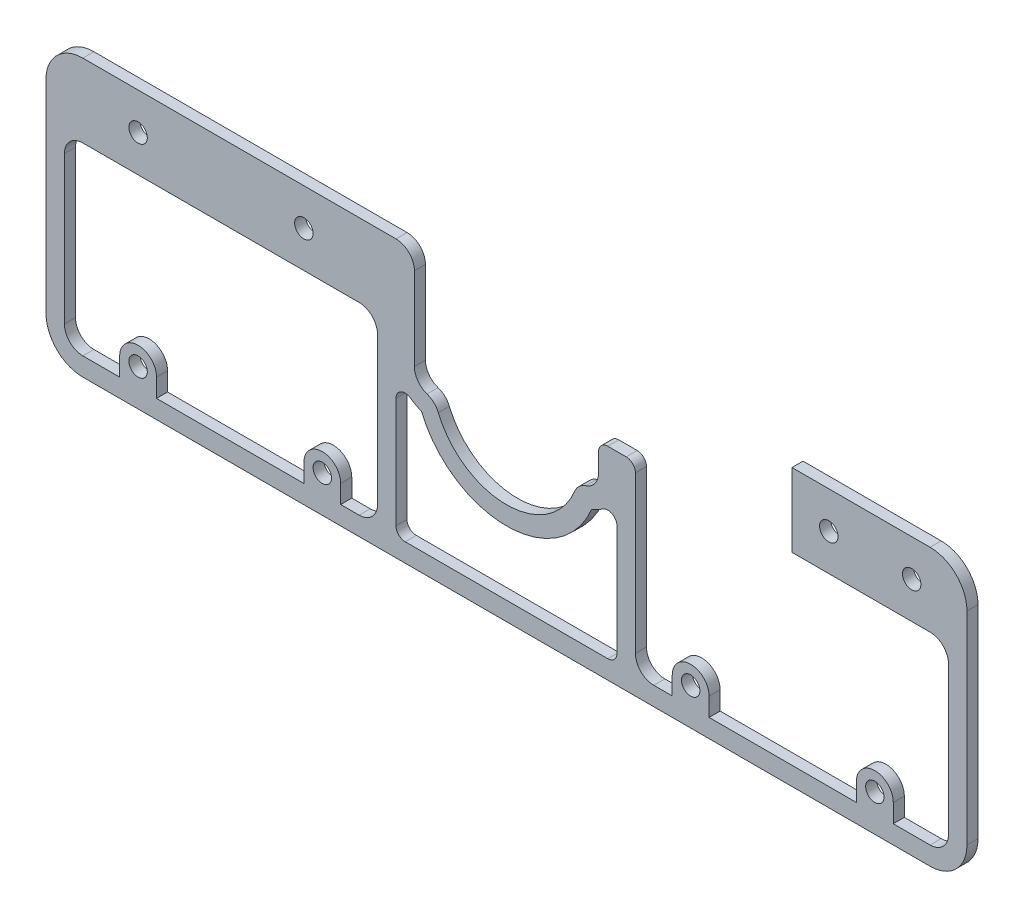
from build123d import *

# Parameters (mm, degrees)
BOSS_EXTRUDE1_DEPTH = 6
SKETCH3_R           = 5
CUT_EXTRUDE1_DEPTH  = 262.076617107
SKETCH4_R           = 5
CUT_EXTRUDE2_DEPTH  = 262.076617107
FILLET4_R           = 5
CUT_EXTRUDE5_DEPTH  = 262.076617107
FILLET5_R           = 5
FILLET6_R           = 5
CUT_EXTRUDE6_DEPTH  = 262.076617107
FILLET7_R           = 5


with BuildPart() as part:
    # Sketch1 → Boss-Extrude1 (new body)
    with BuildSketch(Plane.XY):
        with BuildLine():
            Line((-250, -55), (-250, 3.178280867))
            Line((-250, 3.178280867), (-250, 55))
            ThreePointArc((-250, 55), (-244.142135624, 69.142135624), (-230, 75))
            Line((-230, 75), (-220, 75))
            Line((-220, 75), (-164.330865428, 75))
            Line((-164.330865428, 75), (-60, 75))
            ThreePointArc((-60, 75), (-52.928932188, 72.071067812), (-50, 65))
            Line((-50, 65), (-50, 20))
            ThreePointArc((-50, 20), (-48.100925873, 14.1369803), (-43.125, 10.500822404))
            ThreePointArc((-43.125, 10.500822404), (-39.437786703, 8.32242004), (-37, 4.801315846))
            ThreePointArc((-37, 4.801315846), (-22.271648276, -13.226099426), (0, -20))
            Line((0, -20), (0, -40))
            Line((0, -40), (0, -65))
            Line((0, -65), (0, -75))
            Line((0, -75), (-230, -75))
            ThreePointArc((-230, -75), (-244.142135624, -69.142135624), (-250, -55))
        make_face()
    boss_extrude1 = extrude(amount=BOSS_EXTRUDE1_DEPTH)

    # Mirror1: Boss-Extrude1 across plane
    add(boss_extrude1.mirror(Plane(origin=(0, -20, 6), x_dir=(0, 0, 1), z_dir=(-1, 0, 0))))

    # Sketch3 → Cut-Extrude1 (cut, through all)
    with BuildSketch(Plane.XY.offset(6)):
        with BuildLine():
            Line((155, 35), (155, 75))
            Line((155, 75), (60, 75))
            ThreePointArc((60, 75), (52.928932188, 72.071067812), (50, 65))
            Line((50, 65), (50, 35))
            Line((50, 35), (155, 35))
        make_face()
        with Locations((175, 55)):
            Circle(SKETCH3_R)
        with Locations((220, 55)):
            Circle(SKETCH3_R)
        with Locations((-110, 55)):
            Circle(SKETCH3_R)
        with Locations((-200, 55)):
            Circle(SKETCH3_R)
    extrude(amount=-CUT_EXTRUDE1_DEPTH, mode=Mode.SUBTRACT)

    # Sketch4 → Cut-Extrude2 (cut, through all)
    with BuildSketch(Plane.XY.offset(6)):
        with Locations((-200, -55)):
            Circle(SKETCH4_R)
        with Locations((-100, -55)):
            Circle(SKETCH4_R)
        with BuildLine():
            Line((-70, 25.100979079), (-70, -54.899020921))
            ThreePointArc((-70, -54.899020921), (-72.928932188, -61.970088733), (-80, -64.899020921))
            Line((-80, -64.899020921), (-90, -64.899020921))
            Line((-90, -64.899020921), (-90, -55))
            ThreePointArc((-90, -55), (-100, -45), (-110, -55))
            Line((-110, -55), (-110, -65))
            Line((-110, -65), (-190, -65))
            Line((-190, -65), (-190, -55))
            ThreePointArc((-190, -55), (-200, -45), (-210, -55))
            Line((-210, -55), (-210, -65))
            Line((-210, -65), (-230, -65))
            ThreePointArc((-230, -65), (-237.071067812, -62.071067812), (-240, -55))
            Line((-240, -55), (-240, 25.100979079))
            ThreePointArc((-240, 25.100979079), (-237.071067812, 32.17204689), (-230, 35.100979079))
            Line((-230, 35.100979079), (-140, 35.100979079))
            Line((-140, 35.100979079), (-110, 35.100979079))
            Line((-110, 35.100979079), (-80, 35.100979079))
            ThreePointArc((-80, 35.100979079), (-72.928932188, 32.17204689), (-70, 25.100979079))
        make_face()
    cut_extrude2 = extrude(amount=-CUT_EXTRUDE2_DEPTH, mode=Mode.SUBTRACT)

    # Mirror2: Cut-Extrude2 across plane
    add(cut_extrude2.mirror(Plane(origin=(0, 0, 0), x_dir=(0, 0, 1), z_dir=(1, 0, 0))), mode=Mode.SUBTRACT)

    # Fillet4
    fillet4_edges = [part.edges().sort_by_distance(p)[0] for p in [
        (50, 35, 3),
    ]]
    fillet(fillet4_edges, radius=FILLET4_R)

    # Sketch8 → Cut-Extrude5 (cut, through all)
    with BuildSketch(Plane.XY.offset(6)):
        with BuildLine():
            Line((-60, 0), (-60, -64.899020921))
            Line((-60, -64.899020921), (60, -64.899020921))
            Line((60, -64.899020921), (60, 0))
            ThreePointArc((60, 0), (57.236067977, 4.472135955), (52, 4))
            ThreePointArc((52, 4), (49.247332505, 2.266223145), (46.25, 1.001644808))
            ThreePointArc((46.25, 1.001644808), (0, -30), (-46.25, 1.001644808))
            ThreePointArc((-46.25, 1.001644808), (-49.247332505, 2.266223145), (-52, 4))
            ThreePointArc((-52, 4), (-57.236067977, 4.472135955), (-60, 0))
        make_face()
    extrude(amount=-CUT_EXTRUDE5_DEPTH, mode=Mode.SUBTRACT)

    # Fillet5
    fillet5_edges = [part.edges().sort_by_distance(p)[0] for p in [
        (-60, -64.899020921, 3),
    ]]
    fillet(fillet5_edges, radius=FILLET5_R)

    # Fillet6
    fillet6_edges = [part.edges().sort_by_distance(p)[0] for p in [
        (60, -64.899020921, 3),
    ]]
    fillet(fillet6_edges, radius=FILLET6_R)

    # Sketch9 → Cut-Extrude6 (cut, through all)
    with BuildSketch(Plane.XY.offset(6)):
        with BuildLine():
            Line((78.582472294, 35), (70, 35))
            Line((70, 35), (70, 25.100979079))
            ThreePointArc((70, 25.100979079), (72.444363791, 31.651731819), (78.582472294, 35))
        make_face()
    extrude(amount=-CUT_EXTRUDE6_DEPTH, mode=Mode.SUBTRACT)

    # Fillet7
    fillet7_edges = [part.edges().sort_by_distance(p)[0] for p in [
        (70, 35, 3),
    ]]
    fillet(fillet7_edges, radius=FILLET7_R)


solid = part.part
